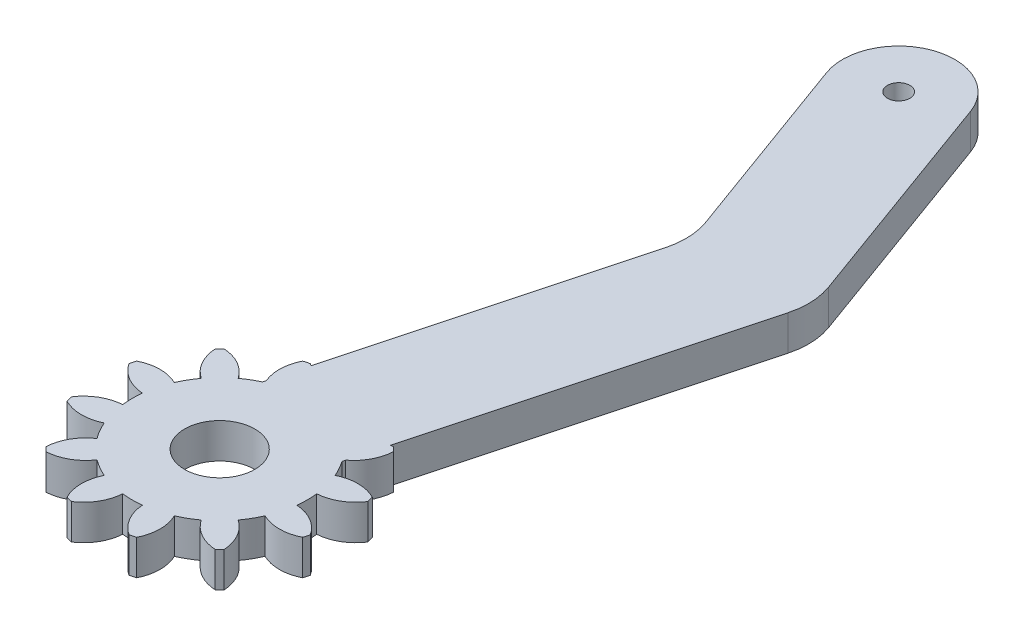
from build123d import *

# Parameters (mm, degrees)
BOSS_EXTRUDE1_DEPTH = 5
FILLET1_RADIUS      = 8
FILLET1_LENGTH      = 5
FILLET2_R           = 10
SKETCH2_R           = 1.6
CUT_EXTRUDE2_DEPTH  = 104.415933465
BOSS_EXTRUDE3_DEPTH = 5
SKETCH6_R           = 5
CUT_EXTRUDE3_DEPTH  = 104.415933465


with BuildPart() as part:
    # Sketch1 → Boss-Extrude1 (new body)
    with BuildSketch(Plane(origin=(0, 0, 0), x_dir=(1, 0, 0), z_dir=(0, 1, 0))):
        with BuildLine():
            Line((10.213282362, 7.206862244), (24.465277218, 60.396031159))
            Line((24.465277218, 60.396031159), (9.059054894, 102.724279115))
            Line((9.059054894, 102.724279115), (-5.976027039, 97.251956822))
            Line((-5.976027039, 97.251956822), (7.704778694, 59.66425199))
            Line((7.704778694, 59.66425199), (-5.241530859, 11.347966966))
            ThreePointArc((-5.241530859, 11.347966966), (-3.235238064, -12.074072829), (10.213282362, 7.206862244))
        make_face()
    extrude(amount=BOSS_EXTRUDE1_DEPTH)

    # Fillet1: full round fillet: the end face becomes a half cylinder, R = half its width
    fillet1_face = Plane((1.541513928, 2.5, -99.988117968), x_dir=(0, 1, 0), z_dir=(-0.342020143326, 0, -0.939692620786))  # on the end face: x along it, z out of the body
    fillet1_slab = fillet1_face.offset(-FILLET1_RADIUS / 2) * Box(FILLET1_LENGTH, 2 * FILLET1_RADIUS, FILLET1_RADIUS, mode=Mode.PRIVATE)  # the body's end, R deep
    fillet1_round = Plane((4.277675075, 2.5, -92.470577002), x_dir=(-0.342020143326, 0, -0.939692620786), z_dir=(0, 1, 0)) * Cylinder(FILLET1_RADIUS, FILLET1_LENGTH, mode=Mode.PRIVATE)  # its axis R under the face
    add(fillet1_slab - fillet1_round, mode=Mode.SUBTRACT)

    # Fillet2
    fillet2_edges = [part.edges().sort_by_distance(p)[0] for p in [
        (7.704778694, 2.5, -59.66425199),
        (24.465277218, 2.5, -60.396031159),
    ]]
    fillet(fillet2_edges, radius=FILLET2_R)

    # Sketch2 → Cut-Extrude2 (cut, through all)
    with BuildSketch(Plane(origin=(0, 5, 0), x_dir=(1, 0, 0), z_dir=(0, 1, 0))):
        with Locations(Location((4.277675074, 92.470577002, 0), (0, 0, 270))):
            Circle(SKETCH2_R)
    extrude(amount=-CUT_EXTRUDE2_DEPTH, mode=Mode.SUBTRACT)

    # Sketch5 → Boss-Extrude3 (add)
    with BuildSketch(Plane(origin=(0, 5, 0), x_dir=(1, 0, 0), z_dir=(0, 1, 0))):
        with BuildLine():
            ThreePointArc((-12.051706508, -12.688828561), (-9.162245044, -11.749370601), (-7.103491322, -9.514845613))
            ThreePointArc((-7.103491322, -9.514845613), (-5.937, -10.283185645), (-4.688352353, -10.909226747))
            ThreePointArc((-4.688352353, -10.909226747), (-5.594130897, -13.809422264), (-4.962994624, -16.781498275))
            ThreePointArc((-4.962994624, -16.781498275), (-4.529333289, -16.90370196), (-4.092669715, -17.014701132))
            ThreePointArc((-4.092669715, -17.014701132), (-2.060051663, -14.756375941), (-1.394381134, -11.791843675))
            ThreePointArc((-1.394381134, -11.791843675), (0, -11.874), (1.394381134, -11.791843675))
            ThreePointArc((1.394381134, -11.791843675), (2.060051663, -14.756375941), (4.092669715, -17.014701132))
            ThreePointArc((4.092669715, -17.014701132), (4.529333289, -16.90370196), (4.962994624, -16.781498275))
            ThreePointArc((4.962994624, -16.781498275), (5.594130897, -13.809422264), (4.688352353, -10.909226747))
            ThreePointArc((4.688352353, -10.909226747), (5.937, -10.283185645), (7.103491322, -9.514845613))
            ThreePointArc((7.103491322, -9.514845613), (9.162245044, -11.749370601), (12.051706508, -12.688828561))
            ThreePointArc((12.051706508, -12.688828561), (12.374368671, -12.374368671), (12.688828561, -12.051706508))
            ThreePointArc((12.688828561, -12.051706508), (11.749370601, -9.162245044), (9.514845613, -7.103491322))
            ThreePointArc((9.514845613, -7.103491322), (10.283185645, -5.937), (10.909226747, -4.688352353))
            ThreePointArc((10.909226747, -4.688352353), (13.809422264, -5.594130897), (16.781498275, -4.962994624))
            ThreePointArc((16.781498275, -4.962994624), (16.90370196, -4.529333289), (17.014701132, -4.092669715))
            ThreePointArc((17.014701132, -4.092669715), (14.756375941, -2.060051663), (11.791843675, -1.394381134))
            ThreePointArc((11.791843675, -1.394381134), (11.874, 0), (11.791843675, 1.394381134))
            ThreePointArc((11.791843675, 1.394381134), (14.756375941, 2.060051663), (17.014701132, 4.092669715))
            ThreePointArc((17.014701132, 4.092669715), (16.90370196, 4.529333289), (16.781498275, 4.962994624))
            ThreePointArc((16.781498275, 4.962994624), (13.809422264, 5.594130897), (10.909226747, 4.688352353))
            ThreePointArc((10.909226747, 4.688352353), (10.283185645, 5.937), (9.514845613, 7.103491322))
            ThreePointArc((9.514845613, 7.103491322), (11.749370601, 9.162245044), (12.688828561, 12.051706508))
            ThreePointArc((12.688828561, 12.051706508), (12.374368671, 12.374368671), (12.051706508, 12.688828561))
            ThreePointArc((12.051706508, 12.688828561), (9.162245044, 11.749370601), (7.103491322, 9.514845613))
            ThreePointArc((7.103491322, 9.514845613), (5.937, 10.283185645), (4.688352353, 10.909226747))
            ThreePointArc((4.688352353, 10.909226747), (5.594130897, 13.809422264), (4.962994624, 16.781498275))
            ThreePointArc((4.962994624, 16.781498275), (4.529333289, 16.90370196), (4.092669715, 17.014701132))
            ThreePointArc((4.092669715, 17.014701132), (2.060051663, 14.756375941), (1.394381134, 11.791843675))
            ThreePointArc((1.394381134, 11.791843675), (0, 11.874), (-1.394381134, 11.791843675))
            ThreePointArc((-1.394381134, 11.791843675), (-2.060051663, 14.756375941), (-4.092669715, 17.014701132))
            ThreePointArc((-4.092669715, 17.014701132), (-4.529333289, 16.90370196), (-4.962994624, 16.781498275))
            ThreePointArc((-4.962994624, 16.781498275), (-5.594130897, 13.809422264), (-4.688352353, 10.909226747))
            ThreePointArc((-4.688352353, 10.909226747), (-5.937, 10.283185645), (-7.103491322, 9.514845613))
            ThreePointArc((-7.103491322, 9.514845613), (-9.162245044, 11.749370601), (-12.051706508, 12.688828561))
            ThreePointArc((-12.051706508, 12.688828561), (-12.374368671, 12.374368671), (-12.688828561, 12.051706508))
            ThreePointArc((-12.688828561, 12.051706508), (-11.749370601, 9.162245044), (-9.514845613, 7.103491322))
            ThreePointArc((-9.514845613, 7.103491322), (-10.283185645, 5.937), (-10.909226747, 4.688352353))
            ThreePointArc((-10.909226747, 4.688352353), (-13.809422264, 5.594130897), (-16.781498275, 4.962994624))
            ThreePointArc((-16.781498275, 4.962994624), (-16.90370196, 4.529333289), (-17.014701132, 4.092669715))
            ThreePointArc((-17.014701132, 4.092669715), (-14.756375941, 2.060051663), (-11.791843675, 1.394381134))
            ThreePointArc((-11.791843675, 1.394381134), (-11.874, 0), (-11.791843675, -1.394381134))
            ThreePointArc((-11.791843675, -1.394381134), (-14.756375941, -2.060051663), (-17.014701132, -4.092669715))
            ThreePointArc((-17.014701132, -4.092669715), (-16.90370196, -4.529333289), (-16.781498275, -4.962994624))
            ThreePointArc((-16.781498275, -4.962994624), (-13.809422264, -5.594130897), (-10.909226747, -4.688352353))
            ThreePointArc((-10.909226747, -4.688352353), (-10.283185645, -5.937), (-9.514845613, -7.103491322))
            ThreePointArc((-9.514845613, -7.103491322), (-11.749370601, -9.162245044), (-12.688828561, -12.051706508))
            ThreePointArc((-12.688828561, -12.051706508), (-12.374368671, -12.374368671), (-12.051706508, -12.688828561))
        make_face()
    extrude(amount=-BOSS_EXTRUDE3_DEPTH)

    # Sketch6 → Cut-Extrude3 (cut, through all)
    with BuildSketch(Plane(origin=(0, 5, 0), x_dir=(1, 0, 0), z_dir=(0, 1, 0))):
        with Locations(Location((0, 0, 0), (0, 0, 270))):
            Circle(SKETCH6_R)
    extrude(amount=-CUT_EXTRUDE3_DEPTH, mode=Mode.SUBTRACT)


solid = part.part
